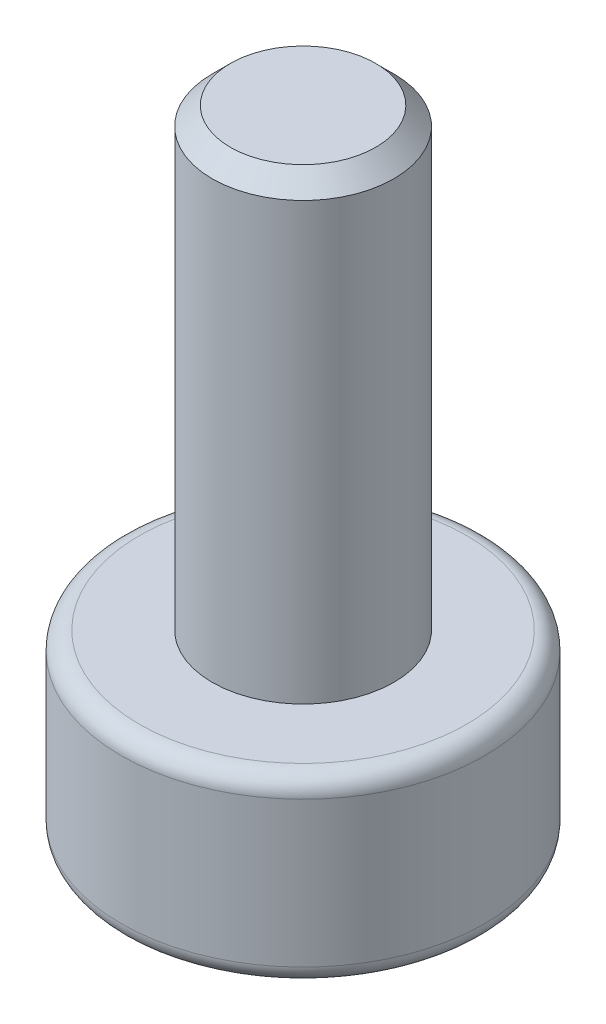
from build123d import *

# Parameters (mm, degrees)
SKETCH_2_R          = 2
EXTRUDE_1_DEPTH     = 2
SKETCH_3_R          = 1
EXTRUDE_2_DEPTH     = 5
FILLET_1_R          = 0.2
SKETCH_4_R          = 0.765
CUT_EXTRUDE_1_DEPTH = 1.52
CHAMFER_1_SIZE      = 0.1
CHAMFER_2_SIZE      = 0.2


with BuildPart() as part:
    # 草图2 → 凸台-拉伸1 (new body)
    with BuildSketch(Plane(origin=(0, 0, 0), x_dir=(1, 0, 0), z_dir=(0, 1, 0))):
        with Locations(Location((0, 0, 0), (0, 0, 270))):
            Circle(SKETCH_2_R)
    extrude(amount=EXTRUDE_1_DEPTH)

    # 草图3 → 凸台-拉伸2 (add)
    with BuildSketch(Plane(origin=(0, 2, 0), x_dir=(1, 0, 0), z_dir=(0, 1, 0))):
        with Locations(Location((0, 0, 0), (0, 0, 270))):
            Circle(SKETCH_3_R)
    extrude(amount=EXTRUDE_2_DEPTH)

    # 圆角1
    fillet_1_edges = [part.edges().sort_by_distance(p)[0] for p in [
        (0, 0, -2),
        (0, 2, -2),
    ]]
    fillet(fillet_1_edges, radius=FILLET_1_R)

    # 草图4 → 切除-拉伸1 (cut)
    with BuildSketch(Plane.XZ):
        with Locations(Location((0, 0, 0), (0, 0, 270))):
            Circle(SKETCH_4_R)
    extrude(amount=-CUT_EXTRUDE_1_DEPTH, mode=Mode.SUBTRACT)

    # 倒角1
    chamfer_1_edges = [part.edges().sort_by_distance(p)[0] for p in [
        (0, 0, 0.765),
    ]]
    chamfer(chamfer_1_edges, length=CHAMFER_1_SIZE)

    # 倒角2
    chamfer_2_edges = [part.edges().sort_by_distance(p)[0] for p in [
        (0, 7, -1),
    ]]
    chamfer(chamfer_2_edges, length=CHAMFER_2_SIZE)


solid = part.part
